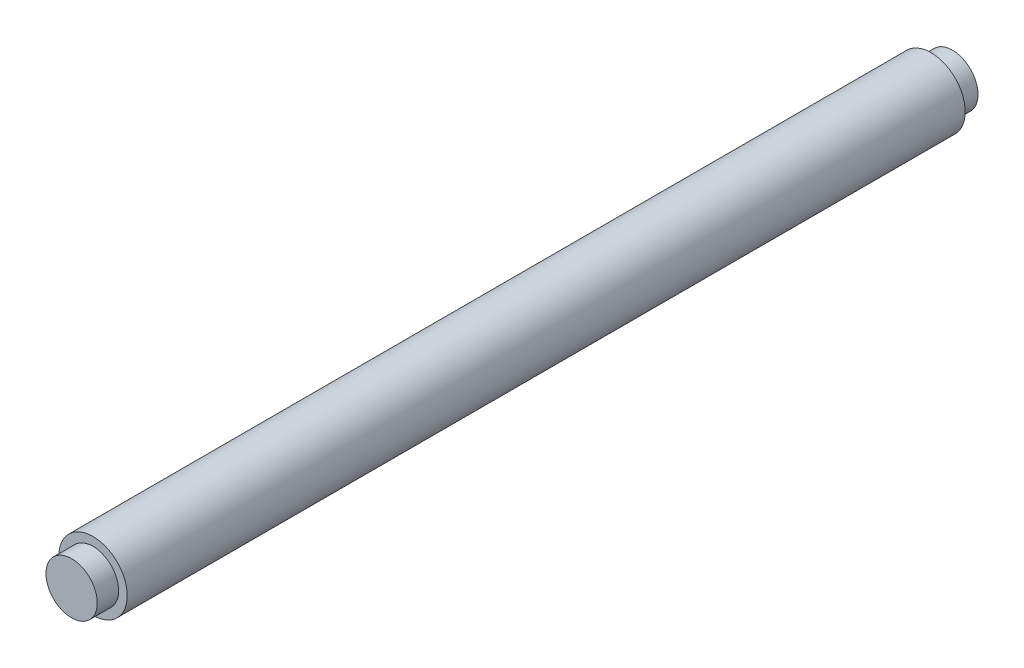
from build123d import *

# Parameters (mm, degrees)
ESQUISSE1_R          = 4
BASE_EXTRUSION_DEPTH = 98
ESQUISSE2_R          = 3
BOSS_EXTRU_1_DEPTH   = 2.5
BOSS_EXTRU_2_START   = 2.5
ESQUISSE3_R          = 3
BOSS_EXTRU_2_DEPTH   = 2.5


with BuildPart() as part:
    # Esquisse1 → Base-Extrusion (new body)
    with BuildSketch(Plane.XY):
        Circle(ESQUISSE1_R)
    extrude(amount=BASE_EXTRUSION_DEPTH)

    # Esquisse2 → Boss.-Extru.1 (add)
    with BuildSketch(Plane.XY.offset(98)):
        Circle(ESQUISSE2_R)
    extrude(amount=BOSS_EXTRU_1_DEPTH)

    # Esquisse3 → Boss.-Extru.2 (add)
    with BuildSketch(Plane(origin=(0, 0, 0), x_dir=(-1, 0, 0), z_dir=(0, 0, -1)).offset(BOSS_EXTRU_2_START)):
        with Locations(Location((0, 0, 0), (0, 0, 180))):
            Circle(ESQUISSE3_R)
    extrude(amount=-BOSS_EXTRU_2_DEPTH)


solid = part.part
